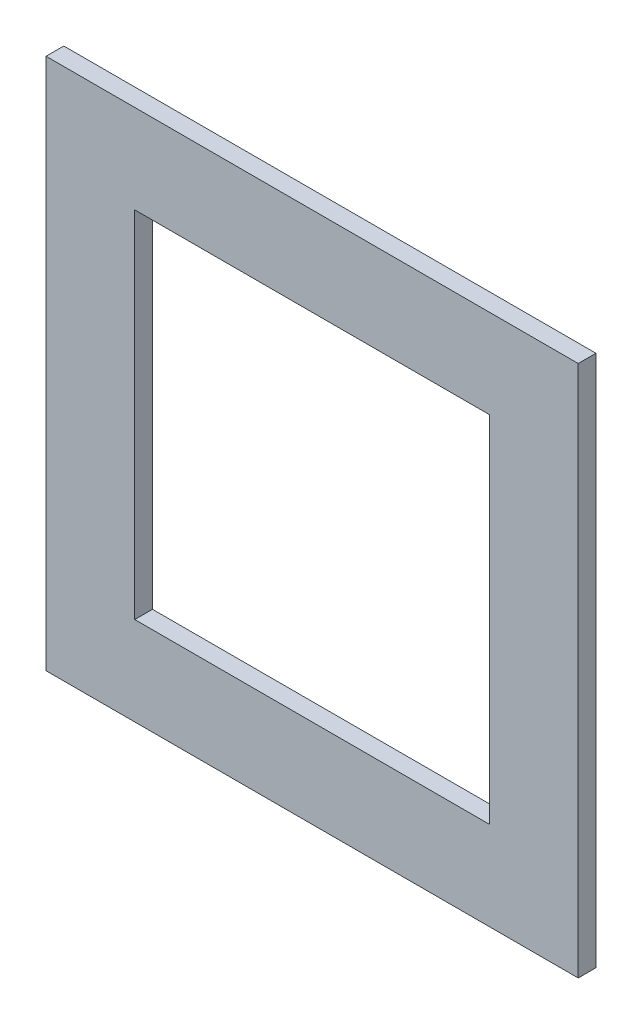
from build123d import *

# Parameters (mm, degrees)
SKETCH1_W           = 300
SKETCH1_H           = 300
SKETCH1_W_2         = 200
SKETCH1_H_2         = 200
BOSS_EXTRUDE1_DEPTH = 10


with BuildPart() as part:
    # Sketch1 → Boss-Extrude1 (new body)
    with BuildSketch(Plane.XY):
        Rectangle(SKETCH1_W, SKETCH1_H)
        Rectangle(SKETCH1_W_2, SKETCH1_H_2, mode=Mode.SUBTRACT)
    extrude(amount=BOSS_EXTRUDE1_DEPTH)


solid = part.part
